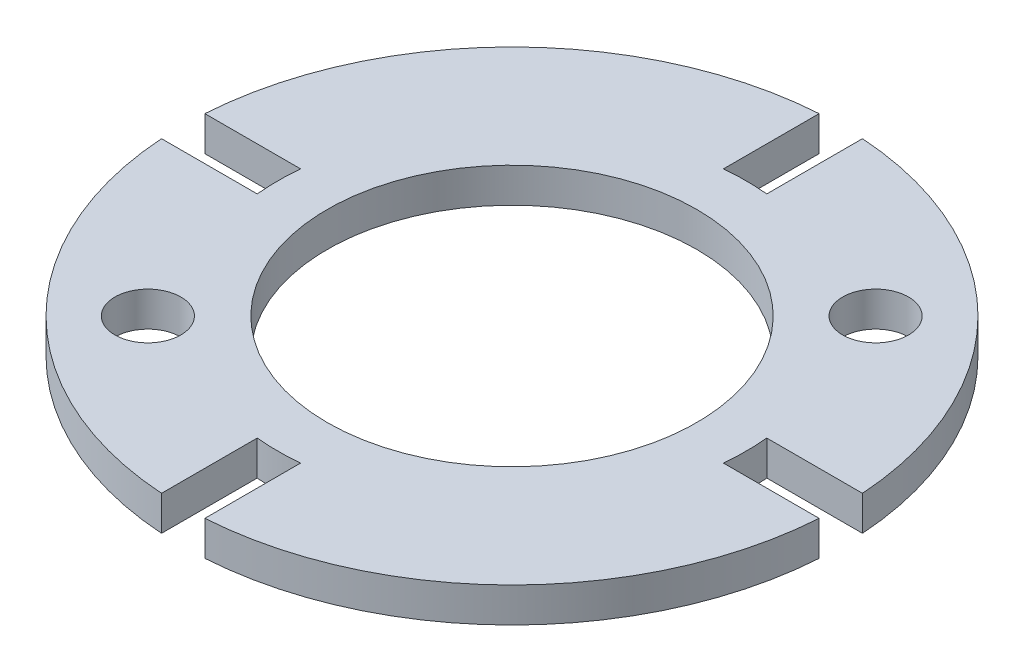
from build123d import *

# Parameters (mm, degrees)
SKETCH1_R           = 48.26
SKETCH1_R_2         = 27.051
BOSS_EXTRUDE1_DEPTH = 5.08
CUT_EXTRUDE1_DEPTH  = 69.438743413
SKETCH3_R           = 4.826
CUT_EXTRUDE2_DEPTH  = 69.29129044


with BuildPart() as part:
    # Sketch1 → Boss-Extrude1 (new body)
    with BuildSketch(Plane(origin=(0, 0, 0), x_dir=(1, 0, 0), z_dir=(0, 1, 0))):
        with Locations(Location((0, 0, 0), (0, 0, 270))):
            Circle(SKETCH1_R)
        with Locations(Location((0, 0, 0), (0, 0, 270))):
            Circle(SKETCH1_R_2, mode=Mode.SUBTRACT)
    extrude(amount=BOSS_EXTRUDE1_DEPTH)

    # Sketch2 → Cut-Extrude1 (cut, through all)
    with BuildSketch(Plane(origin=(0, 5.08, 0), x_dir=(1, 0, 0), z_dir=(0, 1, 0))):
        with BuildLine():
            ThreePointArc((-34.142692849, -3.175), (-34.29, 0), (-34.142692849, 3.175))
            Line((-34.142692849, 3.175), (-48.155445954, 3.175))
            ThreePointArc((-48.155445954, 3.175), (-48.26, 0), (-48.155445954, -3.175))
            Line((-48.155445954, -3.175), (-34.142692849, -3.175))
        make_face()
        with BuildLine():
            ThreePointArc((48.26, 0), (48.233854406, 1.588360519), (48.155445954, 3.175))
            Line((48.155445954, 3.175), (34.142692849, 3.175))
            ThreePointArc((34.142692849, 3.175), (34.29, 0), (34.142692849, -3.175))
            Line((34.142692849, -3.175), (48.155445954, -3.175))
            ThreePointArc((48.155445954, -3.175), (48.233854406, -1.588360519), (48.26, 0))
        make_face()
        with BuildLine():
            Line((-3.175, -34.142692849), (-3.175, -48.155445954))
            ThreePointArc((-3.175, -48.155445954), (0, -48.26), (3.175, -48.155445954))
            Line((3.175, -48.155445954), (3.175, -34.142692849))
            ThreePointArc((3.175, -34.142692849), (0, -34.29), (-3.175, -34.142692849))
        make_face()
        with BuildLine():
            ThreePointArc((3.175, 48.155445954), (0, 48.26), (-3.175, 48.155445954))
            Line((-3.175, 48.155445954), (-3.175, 34.142692849))
            ThreePointArc((-3.175, 34.142692849), (0, 34.29), (3.175, 34.142692849))
            Line((3.175, 34.142692849), (3.175, 48.155445954))
        make_face()
    extrude(amount=-CUT_EXTRUDE1_DEPTH, mode=Mode.SUBTRACT)

    # Sketch3 → Cut-Extrude2 (cut, through all)
    with BuildSketch(Plane(origin=(0, 5.08, 0), x_dir=(1, 0, 0), z_dir=(0, 1, 0))):
        with Locations(Location((-26.665276966, -26.665276966, 0), (0, 0, 270))):
            Circle(SKETCH3_R)
        with Locations(Location((26.626459399, 26.626459399, 0), (0, 0, 270))):
            Circle(SKETCH3_R)
    extrude(amount=-CUT_EXTRUDE2_DEPTH, mode=Mode.SUBTRACT)


solid = part.part
